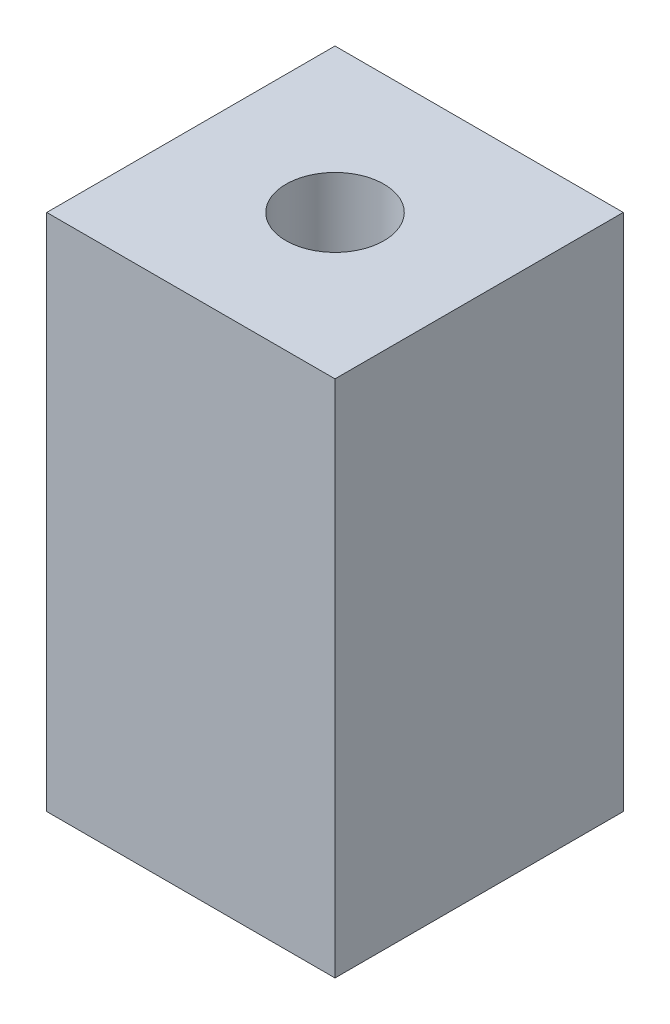
from build123d import *

# Parameters (mm, degrees)
SKETCH2_W           = 15
SKETCH2_H           = 15
SKETCH2_R           = 2.55
BOSS_EXTRUDE1_DEPTH = 27


with BuildPart() as part:
    # Sketch2 → Boss-Extrude1 (new body)
    with BuildSketch(Plane(origin=(0, 0, 0), x_dir=(1, 0, 0), z_dir=(0, 1, 0))):
        Rectangle(SKETCH2_W, SKETCH2_H)
        with Locations(Location((0, 0, 0), (0, 0, 270))):
            Circle(SKETCH2_R, mode=Mode.SUBTRACT)
    extrude(amount=BOSS_EXTRUDE1_DEPTH)


solid = part.part
